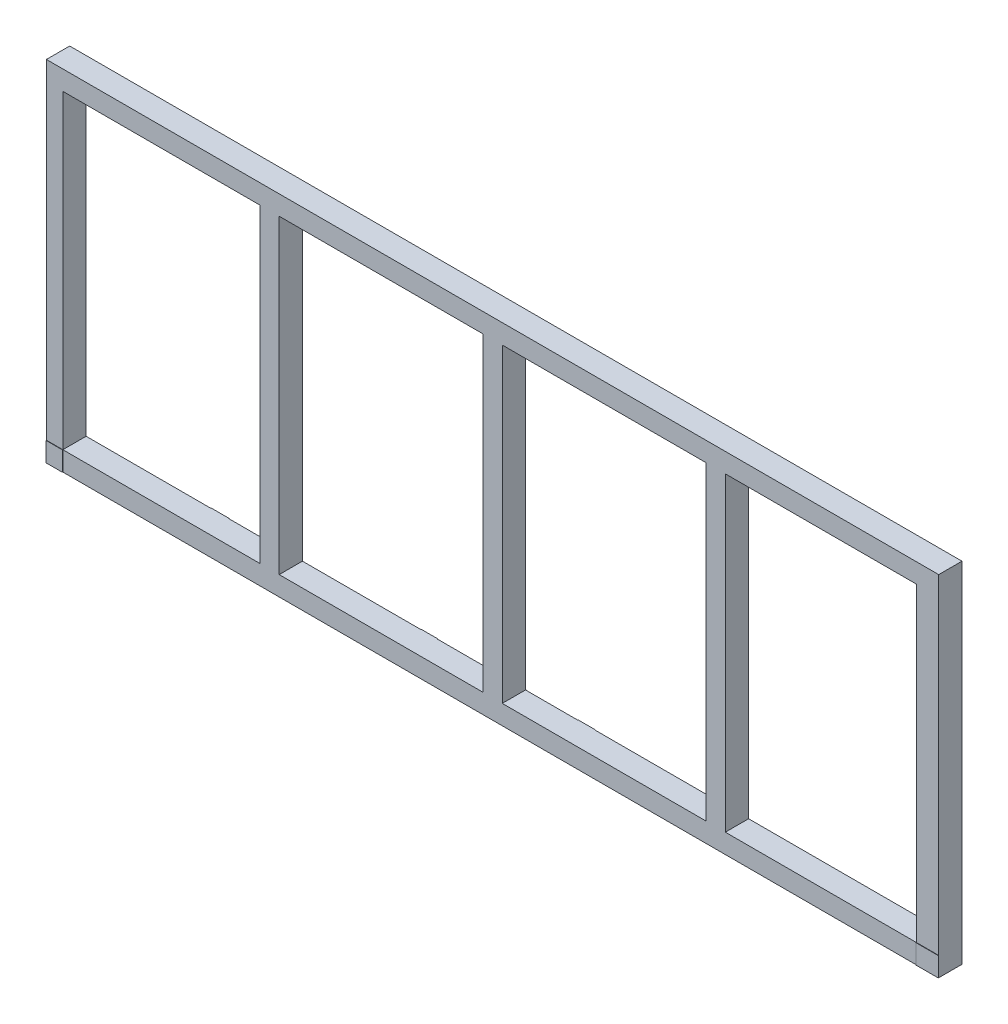
from build123d import *

# Parameters (mm, degrees)
SKETCH1_W           = 2300
SKETCH1_H           = 900
SKETCH1_W_2         = 525
SKETCH1_H_2         = 800
SKETCH1_W_3         = 492.389580631
SKETCH1_W_4         = 507.610419369
BOSS_EXTRUDE1_DEPTH = 60
SKETCH2_W           = 42.389580631
SKETCH2_H           = 50
SKETCH2_W_2         = 57.610419369
BOSS_EXTRUDE2_DEPTH = 1
SKETCH4_W           = 50
SKETCH4_H           = 50.463593603
BOSS_EXTRUDE4_DEPTH = 1
SKETCH5_W           = 44.216514846
SKETCH5_H           = 50
BOSS_EXTRUDE5_DEPTH = 1
SKETCH6_W           = 42.447812038
SKETCH6_H           = 50
BOSS_EXTRUDE6_DEPTH = 1
BOSS_EXTRUDE7_DEPTH = 1


with BuildPart() as part:
    # Sketch1 → Boss-Extrude1 (new body)
    with BuildSketch(Plane.XY):
        Rectangle(SKETCH1_W, SKETCH1_H)
        with Locations((-287.5, 0)):
            Rectangle(SKETCH1_W_2, SKETCH1_H_2, mode=Mode.SUBTRACT)
        with Locations((287.5, 0)):
            Rectangle(SKETCH1_W_2, SKETCH1_H_2, mode=Mode.SUBTRACT)
        with Locations((846.194790316, 0)):
            Rectangle(SKETCH1_W_3, SKETCH1_H_2, mode=Mode.SUBTRACT)
        with Locations((-853.805209685, 0)):
            Rectangle(SKETCH1_W_4, SKETCH1_H_2, mode=Mode.SUBTRACT)
    extrude(amount=BOSS_EXTRUDE1_DEPTH)

    # Sketch2 → Boss-Extrude2 (add)
    with BuildSketch(Plane.XY.offset(60)):
        with Locations((-1128.805209684, -425)):
            Rectangle(SKETCH2_W, SKETCH2_H)
        with Locations((1121.194790316, -425)):
            Rectangle(SKETCH2_W_2, SKETCH2_H)
    extrude(amount=BOSS_EXTRUDE2_DEPTH)

    # Sketch4 → Boss-Extrude4 (add)
    with BuildSketch(Plane(origin=(0, 0, 0), x_dir=(-1, 0, 0), z_dir=(0, 0, -1))):
        with Locations((0, -425.231796802)):
            Rectangle(SKETCH4_W, SKETCH4_H)
    extrude(amount=BOSS_EXTRUDE4_DEPTH)

    # Sketch5 → Boss-Extrude5 (add)
    with BuildSketch(Plane(origin=(0, 0, 0), x_dir=(-1, 0, 0), z_dir=(0, 0, -1))):
        with Locations((-181.41, -425)):
            Rectangle(SKETCH5_W, SKETCH5_H)
    extrude(amount=BOSS_EXTRUDE5_DEPTH)

    # Sketch6 → Boss-Extrude6 (add)
    with BuildSketch(Plane(origin=(0, 0, 0), x_dir=(-1, 0, 0), z_dir=(0, 0, -1))):
        with Locations((223.59, -425)):
            Rectangle(SKETCH6_W, SKETCH6_H)
    extrude(amount=BOSS_EXTRUDE6_DEPTH)

    # Sketch7 → Boss-Extrude7 (add)
    with BuildSketch(Plane(origin=(0, 0, 0), x_dir=(-1, 0, 0), z_dir=(0, 0, -1))):
        Polygon((740.20473979, -400), (763.59, -400), (786.97526021, -400), (786.97526021, -450), (763.59, -450), (740.20473979, -450), align=None)
    extrude(amount=BOSS_EXTRUDE7_DEPTH)


solid = part.part
